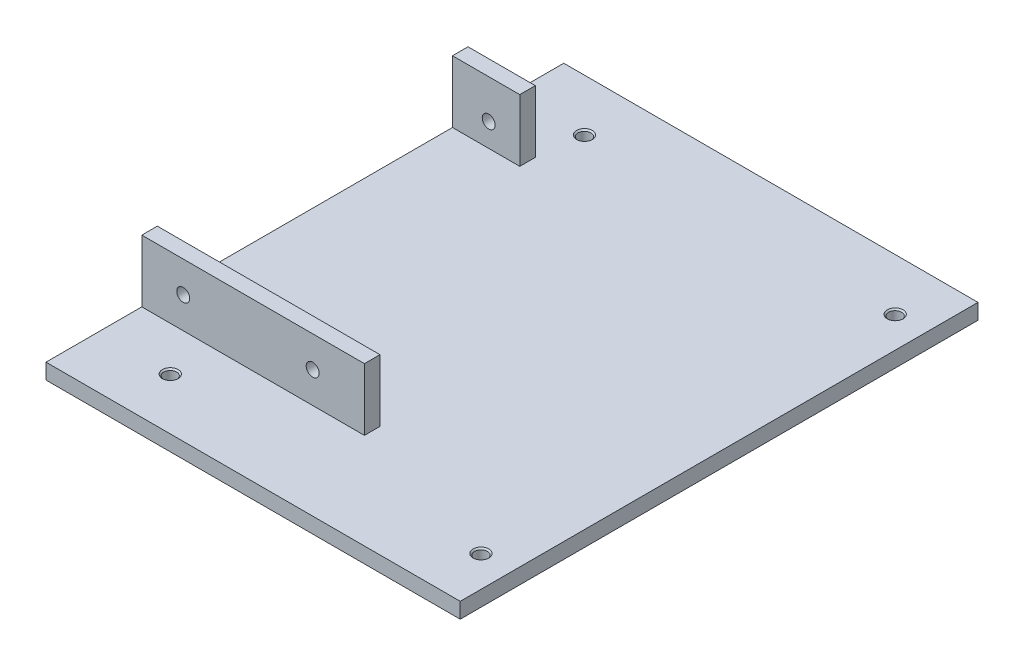
from build123d import *

# Parameters (mm, degrees)
SKETCH_1_W                   = 80
SKETCH_1_H                   = 100
EXTRUDE_1_DEPTH              = 3
SKETCH_2_W                   = 97
SKETCH_2_H                   = 57
SKETCH_2_W_2                 = 91
SKETCH_2_H_2                 = 51
EXTRUDE_2_DEPTH              = 45
SKETCH_3_W                   = 3
SKETCH_3_H                   = 34
EXTRUDE_3_DEPTH              = 51
SKETCH_4_W                   = 30
SKETCH_4_H                   = 6
CUT_EXTRUDE_2_DEPTH          = 50
SKETCH_5_W                   = 57
SKETCH_5_H                   = 57
SKETCH_5_W_2                 = 51
SKETCH_5_H_2                 = 51
EXTRUDE_4_DEPTH              = 30
HOLE_WIZARD_M3_1_D           = 2.5
HOLE_WIZARD_M3_1_CSINK_D     = 3.05
HOLE_WIZARD_M3_1_CSINK_ANGLE = 90
SKETCH_9_W                   = 3
SKETCH_9_H                   = 57
CUT_EXTRUDE_3_DEPTH          = 27
SKETCH_10_W                  = 50
SKETCH_10_H                  = 8
CUT_EXTRUDE_4_DEPTH          = 30
HOLE_WIZARD_M3_3_D           = 2.5
HOLE_WIZARD_M3_3_DEPTH       = 3
HOLE_WIZARD_M3_4_D           = 2.5
HOLE_WIZARD_M3_4_DEPTH       = 3
SKETCH_23_W                  = 43
SKETCH_23_H                  = 12
EXTRUDE_8_DEPTH              = 3
SKETCH_28_W                  = 13
SKETCH_28_H                  = 12
EXTRUDE_9_DEPTH              = 3
SKETCH_31_W                  = 57
SKETCH_31_H                  = 45
CUT_EXTRUDE_5_DEPTH          = 130.801793915
SKETCH_32_W                  = 54
SKETCH_32_H                  = 57
CUT_EXTRUDE_6_DEPTH          = 139.588165155
SKETCH_37_W                  = 1.25
SKETCH_37_H                  = 3
HOLE_WIZARD_M3_5_AT_2_COUNT  = 2
HOLE_WIZARD_M3_5_AT_2_PITCH  = 25
SKETCH_39_W                  = 1.25
SKETCH_39_H                  = 3


with BuildPart() as part:
    # 草图1 → 凸台-拉伸1 (new body)
    with BuildSketch(Plane(origin=(0, 0, 0), x_dir=(1, 0, 0), z_dir=(0, 1, 0))):
        with Locations((-20.765734509, -21.662442769)):
            Rectangle(SKETCH_1_W, SKETCH_1_H)
    extrude(amount=EXTRUDE_1_DEPTH)

    # 草图2 → 凸台-拉伸2 (add)
    with BuildSketch(Plane(origin=(0, 3, 0), x_dir=(1, 0, 0), z_dir=(0, 1, 0))):
        with Locations((-66.265734509, -21.662442769)):
            Rectangle(SKETCH_2_W, SKETCH_2_H)
        with Locations((-66.265734509, -21.662442769)):
            Rectangle(SKETCH_2_W_2, SKETCH_2_H_2, mode=Mode.SUBTRACT)
    extrude(amount=EXTRUDE_2_DEPTH)

    # 草图3 → 凸台-拉伸3 (add)
    with BuildSketch(Plane.XY.offset(-3.837557231)):
        with Locations((-73.265734509, 31)):
            Rectangle(SKETCH_3_W, SKETCH_3_H)
    extrude(amount=EXTRUDE_3_DEPTH)

    # 草图4 → 切除-拉伸2 (cut)
    with BuildSketch(Plane(origin=(0, 0, -6.837557231), x_dir=(-1, 0, 0), z_dir=(0, 0, -1))):
        with Locations((32.765734509, 6)):
            Rectangle(SKETCH_4_W, SKETCH_4_H)
    extrude(amount=-CUT_EXTRUDE_2_DEPTH, mode=Mode.SUBTRACT)

    # 草图5 → 凸台-拉伸4 (add)
    with BuildSketch(Plane.XZ.offset(-3)):
        with Locations((-86.265734509, 21.662442769)):
            Rectangle(SKETCH_5_W, SKETCH_5_H)
        with Locations((-86.265734509, 21.662442769)):
            Rectangle(SKETCH_5_W_2, SKETCH_5_H_2, mode=Mode.SUBTRACT)
    extrude(amount=EXTRUDE_4_DEPTH)

    # M3 螺纹孔1 (through all)
    with Locations(Plane(origin=(0, 3, 0), x_dir=(1, 0, 0), z_dir=(0, 1, 0))):
        with Locations((-46.765734509, 18.337557231), (13.234265491, 18.337557231), (13.234265491, -61.662442769), (-46.765734509, -61.662442769)):
            CounterSinkHole(HOLE_WIZARD_M3_1_D / 2, HOLE_WIZARD_M3_1_CSINK_D / 2, counter_sink_angle=HOLE_WIZARD_M3_1_CSINK_ANGLE)

    # 草图9 → 切除-拉伸3 (cut)
    with BuildSketch(Plane(origin=(0, -27, 0), x_dir=(-1, 0, 0), z_dir=(0, -1, 0))):
        with Locations((59.265734509, -21.662442769)):
            Rectangle(SKETCH_9_W, SKETCH_9_H)
    extrude(amount=-CUT_EXTRUDE_3_DEPTH, mode=Mode.SUBTRACT)

    # 草图10 → 切除-拉伸4 (cut)
    with BuildSketch(Plane(origin=(-17.765734509, 0, 0), x_dir=(0, 0, -1), z_dir=(1, 0, 0))):
        with Locations((-18.162442769, 7)):
            Rectangle(SKETCH_10_W, SKETCH_10_H)
    extrude(amount=-CUT_EXTRUDE_4_DEPTH, mode=Mode.SUBTRACT)

    # M3 螺纹孔3
    with Locations(Plane(origin=(0, 0, -6.837557231), x_dir=(-1, 0, 0), z_dir=(0, 0, -1))):
        with Locations((53.765734509, 7.5)):
            Hole(HOLE_WIZARD_M3_3_D / 2, depth=HOLE_WIZARD_M3_3_DEPTH)

    # M3 螺纹孔4
    with Locations(Plane.XY.offset(50.162442769)):
        with Locations((-52.765734509, 9), (-27.765734509, 9)):
            Hole(HOLE_WIZARD_M3_4_D / 2, depth=HOLE_WIZARD_M3_4_DEPTH)

    # 草图31 → 切除-拉伸5 (cut, through all)
    with BuildSketch(Plane(origin=(-17.765734509, 0, 0), x_dir=(0, 0, -1), z_dir=(1, 0, 0))):
        with Locations((-21.662442769, 25.5)):
            Rectangle(SKETCH_31_W, SKETCH_31_H)
    extrude(amount=-CUT_EXTRUDE_5_DEPTH, mode=Mode.SUBTRACT)

    # 草图32 → 切除-拉伸6 (cut, through all)
    with BuildSketch(Plane(origin=(0, 3, 0), x_dir=(1, 0, 0), z_dir=(0, 1, 0))):
        with Locations((-87.765734509, -21.662442769)):
            Rectangle(SKETCH_32_W, SKETCH_32_H)
    extrude(amount=-CUT_EXTRUDE_6_DEPTH, mode=Mode.SUBTRACT)


with BuildPart() as body_2:
    # 草图23 → 凸台-拉伸8 (new body)
    with BuildSketch(Plane.XY.offset(50.162442769)):
        with Locations((-39.265734509, 9)):
            Rectangle(SKETCH_23_W, SKETCH_23_H)
    extrude(amount=EXTRUDE_8_DEPTH)

    # 草图37 → M3 螺纹孔5 (revolve, cut)
    with BuildSketch(Plane(origin=(-52.765734509, 9, 53.162442769), x_dir=(0, -1, 0), z_dir=(1, 0, 0))):
        with Locations((0.625, 1.5)):
            Rectangle(SKETCH_37_W, SKETCH_37_H)
    hole_wizard_m3_5 = revolve(axis=Axis((-52.765734509, 9, 59.512442769), (0, 0, -1)), mode=Mode.SUBTRACT)

    # M3 螺纹孔5 at 2: M3 螺纹孔5 ×2
    with Locations(*[(i * HOLE_WIZARD_M3_5_AT_2_PITCH, 0, 0) for i in range(1, HOLE_WIZARD_M3_5_AT_2_COUNT)]):
        add(hole_wizard_m3_5, mode=Mode.SUBTRACT)


with BuildPart() as body_3:
    # 草图28 → 凸台-拉伸9 (new body)
    with BuildSketch(Plane(origin=(0, 0, -6.837557231), x_dir=(-1, 0, 0), z_dir=(0, 0, -1))):
        with Locations((54.265734509, 9)):
            Rectangle(SKETCH_28_W, SKETCH_28_H)
    extrude(amount=EXTRUDE_9_DEPTH)

    # 草图39 → M3 螺纹孔6 (revolve, cut)
    with BuildSketch(Plane(origin=(-53.765734509, 7.5, -9.837557231), x_dir=(0, 1, 0), z_dir=(1, 0, 0))):
        with Locations((0.625, 1.5)):
            Rectangle(SKETCH_39_W, SKETCH_39_H)
    revolve(axis=Axis((-53.765734509, 7.5, -16.187557231), (0, 0, 1)), mode=Mode.SUBTRACT)


solid = Compound([part.part, body_2.part, body_3.part])
